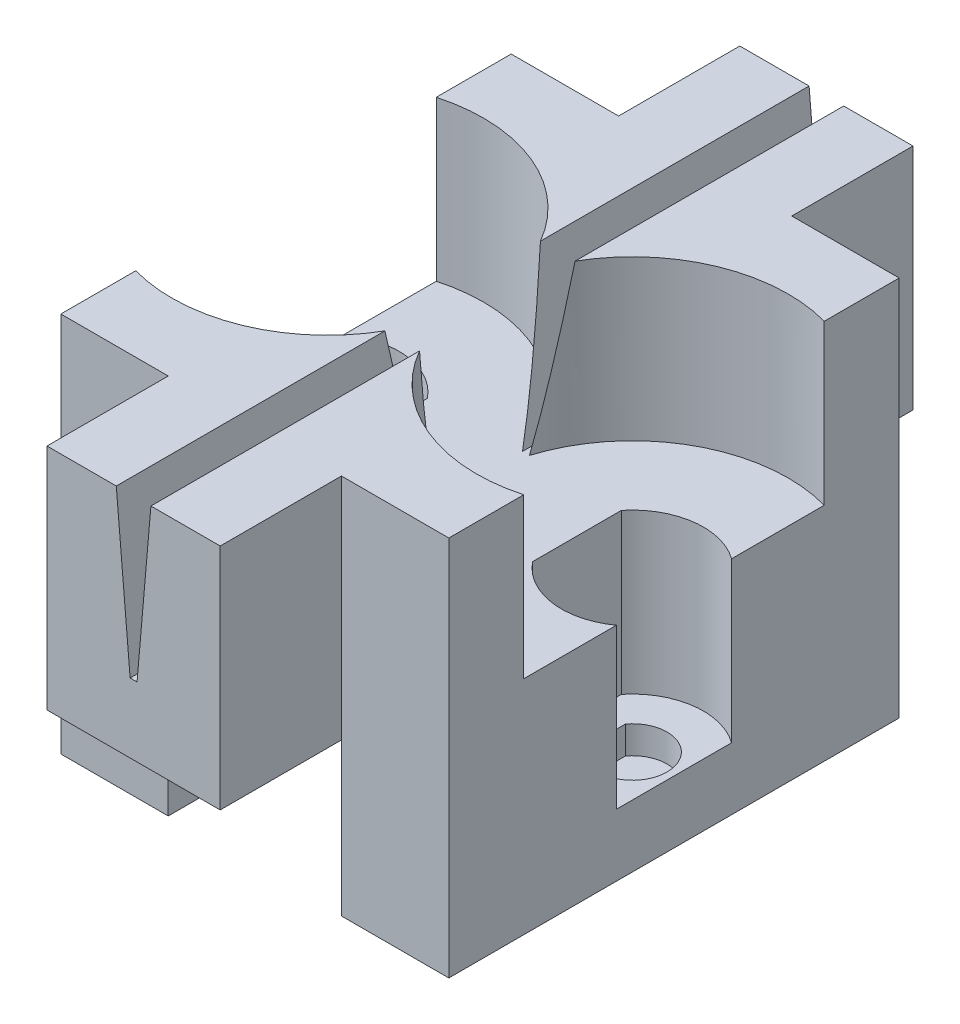
from build123d import *

# Parameters (mm, degrees)
SKETCH1_W           = 56
SKETCH1_H           = 100
BOSS_EXTRUDE1_DEPTH = 55
CUT_EXTRUDE2_DEPTH  = 118.511701545
SKETCH7_R           = 22.5
SKETCH7_R_2         = 10
CUT_EXTRUDE4_DEPTH  = 23
CUT_EXTRUDE5_DEPTH  = 46
CUT_EXTRUDE6_DEPTH  = 4
CUT_EXTRUDE7_DEPTH  = 23
SKETCH12_W          = 15.5
SKETCH12_H          = 17.5
CUT_EXTRUDE8_DEPTH  = 80.429213769
SKETCH13_W          = 25
SKETCH13_H          = 22
CUT_EXTRUDE9_DEPTH  = 118.511701545


with BuildPart() as part:
    # Sketch1 → Boss-Extrude1 (new body)
    with BuildSketch(Plane(origin=(0, 0, 0), x_dir=(1, 0, 0), z_dir=(0, 1, 0))):
        Rectangle(SKETCH1_W, SKETCH1_H)
    extrude(amount=BOSS_EXTRUDE1_DEPTH)

    # Sketch3 → Cut-Extrude2 (cut, through all)
    with BuildSketch(Plane.XY.offset(50)):
        Polygon((-0.5, 32), (-2.5, 55), (2.5, 55), (0.5, 32), align=None)
    extrude(amount=-CUT_EXTRUDE2_DEPTH, mode=Mode.SUBTRACT)

    # Sketch7 → Cut-Extrude4 (cut)
    with BuildSketch(Plane(origin=(0, 55, 0), x_dir=(1, 0, 0), z_dir=(0, 1, 0))):
        with Locations((22, 0)):
            Circle(SKETCH7_R)
        with Locations((22, 0)):
            Circle(SKETCH7_R_2, mode=Mode.SUBTRACT)
    cut_extrude4 = extrude(amount=-CUT_EXTRUDE4_DEPTH, mode=Mode.SUBTRACT)

    # Sketch9 → Cut-Extrude5 (cut)
    with BuildSketch(Plane(origin=(0, 55, 0), x_dir=(1, 0, 0), z_dir=(0, 1, 0))):
        with BuildLine():
            Line((14, 6.408002809), (14, -6.408002809))
            ThreePointArc((14, -6.408002809), (32.25, 0), (14, 6.408002809))
        make_face()
    cut_extrude5 = extrude(amount=-CUT_EXTRUDE5_DEPTH, mode=Mode.SUBTRACT)

    # Sketch10 → Cut-Extrude6 (cut)
    with BuildSketch(Plane(origin=(0, 9, 0), x_dir=(1, 0, 0), z_dir=(0, 1, 0))):
        with BuildLine():
            Line((18, 3), (18, -3))
            ThreePointArc((18, -3), (27, 0), (18, 3))
        make_face()
    cut_extrude6 = extrude(amount=-CUT_EXTRUDE6_DEPTH, mode=Mode.SUBTRACT)

    # Sketch11 → Cut-Extrude7 (cut)
    with BuildSketch(Plane(origin=(0, 55, 0), x_dir=(1, 0, 0), z_dir=(0, 1, 0))):
        with BuildLine():
            Line((14, 6.408002809), (14, -6.408002809))
            ThreePointArc((14, -6.408002809), (11.677076266, 0), (14, 6.408002809))
        make_face()
    cut_extrude7 = extrude(amount=-CUT_EXTRUDE7_DEPTH, mode=Mode.SUBTRACT)

    # Mirror1: Cut-Extrude4, Cut-Extrude5, Cut-Extrude6, Cut-Extrude7 across plane
    add(cut_extrude4.mirror(Plane(origin=(0, 0, 0), x_dir=(0, 0, 1), z_dir=(1, 0, 0))), mode=Mode.SUBTRACT)
    add(cut_extrude5.mirror(Plane(origin=(0, 0, 0), x_dir=(0, 0, 1), z_dir=(1, 0, 0))), mode=Mode.SUBTRACT)
    add(cut_extrude6.mirror(Plane(origin=(0, 0, 0), x_dir=(0, 0, 1), z_dir=(1, 0, 0))), mode=Mode.SUBTRACT)
    add(cut_extrude7.mirror(Plane(origin=(0, 0, 0), x_dir=(0, 0, 1), z_dir=(1, 0, 0))), mode=Mode.SUBTRACT)

    # Sketch12 → Cut-Extrude8 (cut, through all)
    with BuildSketch(Plane(origin=(0, 55, 0), x_dir=(1, 0, 0), z_dir=(0, 1, 0))):
        with Locations((-20.25, 41.25)):
            Rectangle(SKETCH12_W, SKETCH12_H)
        with Locations((20.25, 41.25)):
            Rectangle(SKETCH12_W, SKETCH12_H)
        with Locations((-20.25, -41.25)):
            Rectangle(SKETCH12_W, SKETCH12_H)
        with Locations((20.25, -41.25)):
            Rectangle(SKETCH12_W, SKETCH12_H)
    extrude(amount=-CUT_EXTRUDE8_DEPTH, mode=Mode.SUBTRACT)

    # Sketch13 → Cut-Extrude9 (cut, through all)
    with BuildSketch(Plane.XY.offset(50)):
        with Locations((0, 11)):
            Rectangle(SKETCH13_W, SKETCH13_H)
    extrude(amount=-CUT_EXTRUDE9_DEPTH, mode=Mode.SUBTRACT)


solid = part.part
